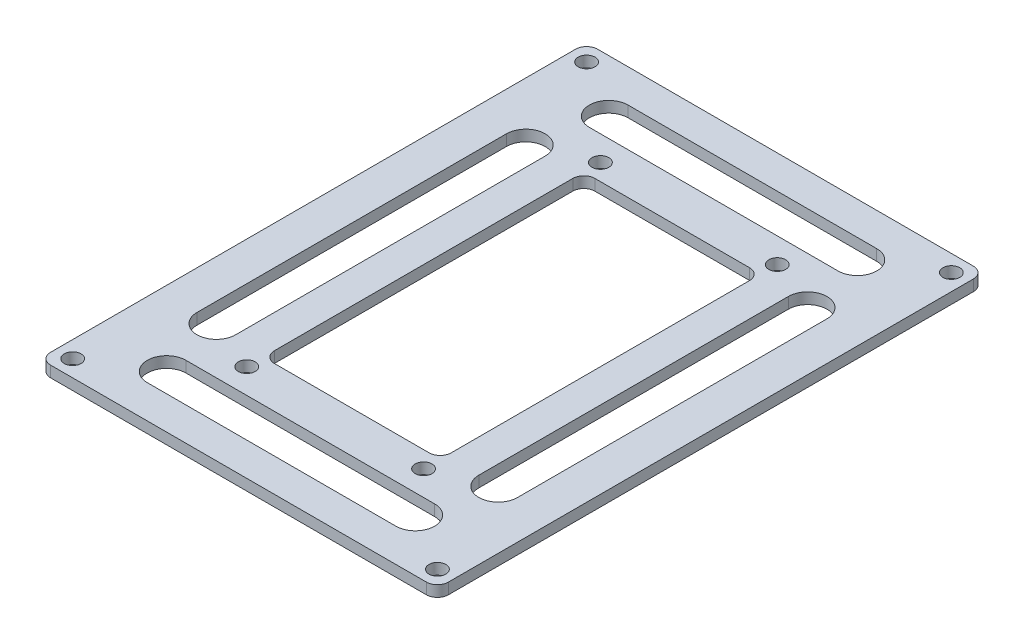
from build123d import *

# Parameters (mm, degrees)
SKETCH_1_W          = 72
SKETCH_1_H          = 99
EXTRUDE_1_DEPTH     = 2
SKETCH_3_R          = 1.525
CUT_EXTRUDE_1_DEPTH = 2
SKETCH_4_R          = 1.525
CUT_EXTRUDE_2_DEPTH = 2
SKETCH_5_W          = 32
SKETCH_5_H          = 58
CUT_EXTRUDE_3_DEPTH = 2
FILLET_1_R          = 2
CUT_EXTRUDE_4_DEPTH = 2
FILLET_2_R          = 2


with BuildPart() as part:
    # 草图1 → 凸台-拉伸1 (new body)
    with BuildSketch(Plane(origin=(0, 0, 0), x_dir=(1, 0, 0), z_dir=(0, 1, 0))):
        Rectangle(SKETCH_1_W, SKETCH_1_H)
    extrude(amount=EXTRUDE_1_DEPTH)

    # 草图3 → 切除-拉伸1 (cut)
    with BuildSketch(Plane(origin=(0, 2, 0), x_dir=(1, 0, 0), z_dir=(0, 1, 0))):
        with Locations(Location((33, 46.5, 0), (0, 0, 270))):
            Circle(SKETCH_3_R)
        with Locations(Location((-33, 46.5, 0), (0, 0, 270))):
            Circle(SKETCH_3_R)
        with Locations(Location((-33, -46.5, 0), (0, 0, 270))):
            Circle(SKETCH_3_R)
        with Locations(Location((33, -46.5, 0), (0, 0, 270))):
            Circle(SKETCH_3_R)
    extrude(amount=-CUT_EXTRUDE_1_DEPTH, mode=Mode.SUBTRACT)

    # 草图4 → 切除-拉伸2 (cut)
    with BuildSketch(Plane(origin=(0, 2, 0), x_dir=(1, 0, 0), z_dir=(0, 1, 0))):
        with Locations(Location((16, -32, 0), (0, 0, 270))):
            Circle(SKETCH_4_R)
        with Locations(Location((-16, -32, 0), (0, 0, 270))):
            Circle(SKETCH_4_R)
        with Locations(Location((-16, 32, 0), (0, 0, 270))):
            Circle(SKETCH_4_R)
        with Locations(Location((16, 32, 0), (0, 0, 270))):
            Circle(SKETCH_4_R)
    extrude(amount=-CUT_EXTRUDE_2_DEPTH, mode=Mode.SUBTRACT)

    # 草图5 → 切除-拉伸3 (cut)
    with BuildSketch(Plane(origin=(0, 2, 0), x_dir=(1, 0, 0), z_dir=(0, 1, 0))):
        Rectangle(SKETCH_5_W, SKETCH_5_H)
    extrude(amount=-CUT_EXTRUDE_3_DEPTH, mode=Mode.SUBTRACT)

    # 圆角1
    fillet_1_edges = [part.edges().sort_by_distance(p)[0] for p in [
        (16, 1, -29),
        (16, 1, 29),
        (-16, 1, 29),
        (-16, 1, -29),
    ]]
    fillet(fillet_1_edges, radius=FILLET_1_R)

    # 草图6 → 切除-拉伸4 (cut)
    with BuildSketch(Plane(origin=(0, 2, 0), x_dir=(1, 0, 0), z_dir=(0, 1, 0))):
        with BuildLine():
            Line((22, -28), (22, 28))
            ThreePointArc((22, 28), (25.5, 31.5), (29, 28))
            Line((29, 28), (29, -28))
            ThreePointArc((29, -28), (25.5, -31.5), (22, -28))
        make_face()
        with BuildLine():
            Line((-22, -28), (-22, 28))
            ThreePointArc((-22, 28), (-25.5, 31.5), (-29, 28))
            Line((-29, 28), (-29, -28))
            ThreePointArc((-29, -28), (-25.5, -31.5), (-22, -28))
        make_face()
        with BuildLine():
            Line((-22.5, 43.5), (22.5, 43.5))
            ThreePointArc((22.5, 43.5), (26, 40), (22.5, 36.5))
            Line((22.5, 36.5), (-22.5, 36.5))
            ThreePointArc((-22.5, 36.5), (-26, 40), (-22.5, 43.5))
        make_face()
        with BuildLine():
            Line((-22.5, -43.5), (22.5, -43.5))
            ThreePointArc((22.5, -43.5), (26, -40), (22.5, -36.5))
            Line((22.5, -36.5), (-22.5, -36.5))
            ThreePointArc((-22.5, -36.5), (-26, -40), (-22.5, -43.5))
        make_face()
    extrude(amount=-CUT_EXTRUDE_4_DEPTH, mode=Mode.SUBTRACT)

    # 圆角2
    fillet_2_edges = [part.edges().sort_by_distance(p)[0] for p in [
        (36, 1, 49.5),
        (-36, 1, 49.5),
        (-36, 1, -49.5),
        (36, 1, -49.5),
    ]]
    fillet(fillet_2_edges, radius=FILLET_2_R)


solid = part.part
